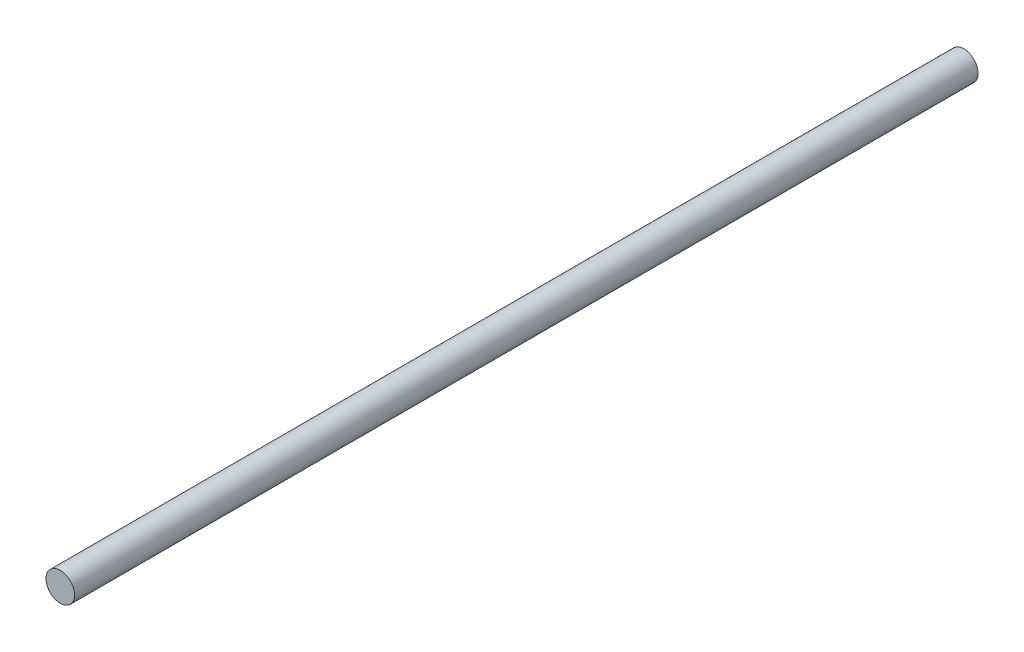
from build123d import *

# Parameters (mm, degrees)
SKETCH1_R           = 3.81
BOSS_EXTRUDE1_DEPTH = 241.3


with BuildPart() as part:
    # Sketch1 → Boss-Extrude1 (new body)
    with BuildSketch(Plane.XY):
        with Locations(Location((0, 0, 0), (0, 0, 180))):
            Circle(SKETCH1_R)
    extrude(amount=BOSS_EXTRUDE1_DEPTH)


solid = part.part
